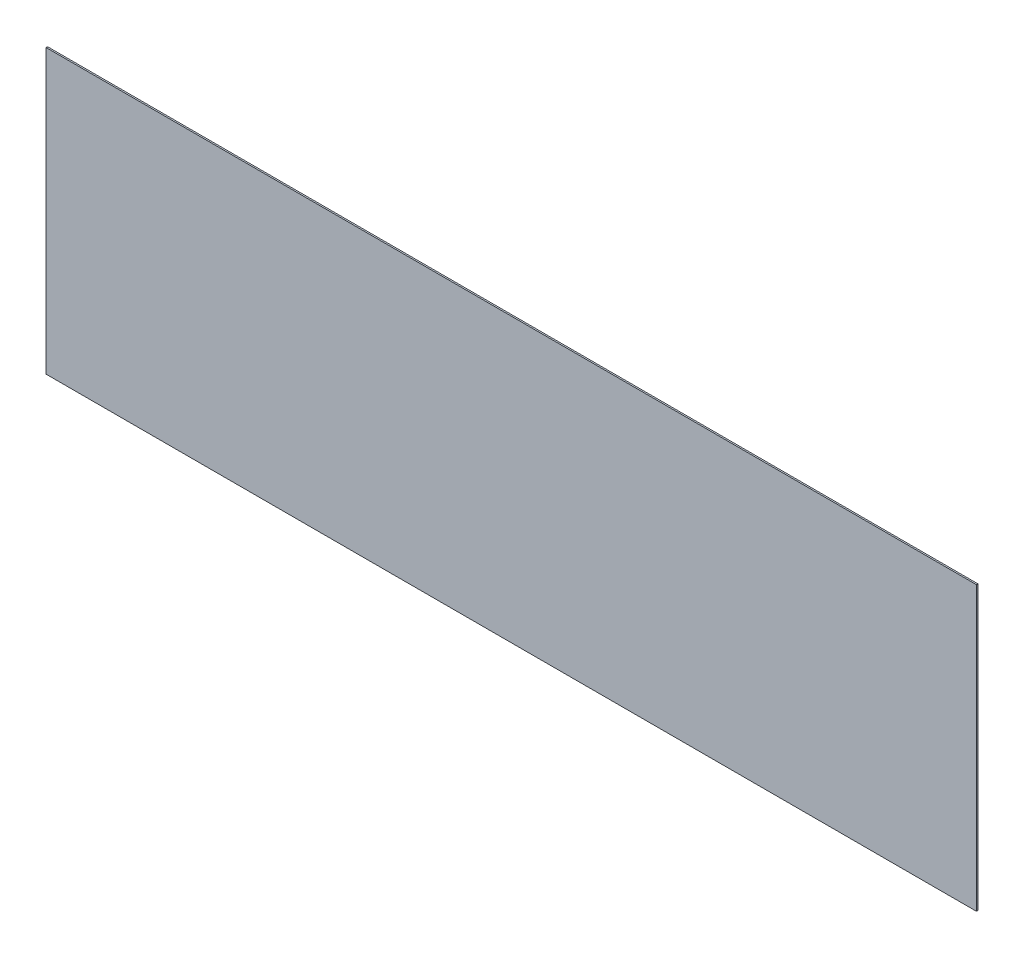
from build123d import *

# Parameters (mm, degrees)
SKETCH1_W           = 2500
SKETCH1_H           = 760
BOSS_EXTRUDE1_DEPTH = 4


with BuildPart() as part:
    # Sketch1 → Boss-Extrude1 (new body)
    with BuildSketch(Plane.XY):
        Rectangle(SKETCH1_W, SKETCH1_H)
    extrude(amount=BOSS_EXTRUDE1_DEPTH)


solid = part.part
